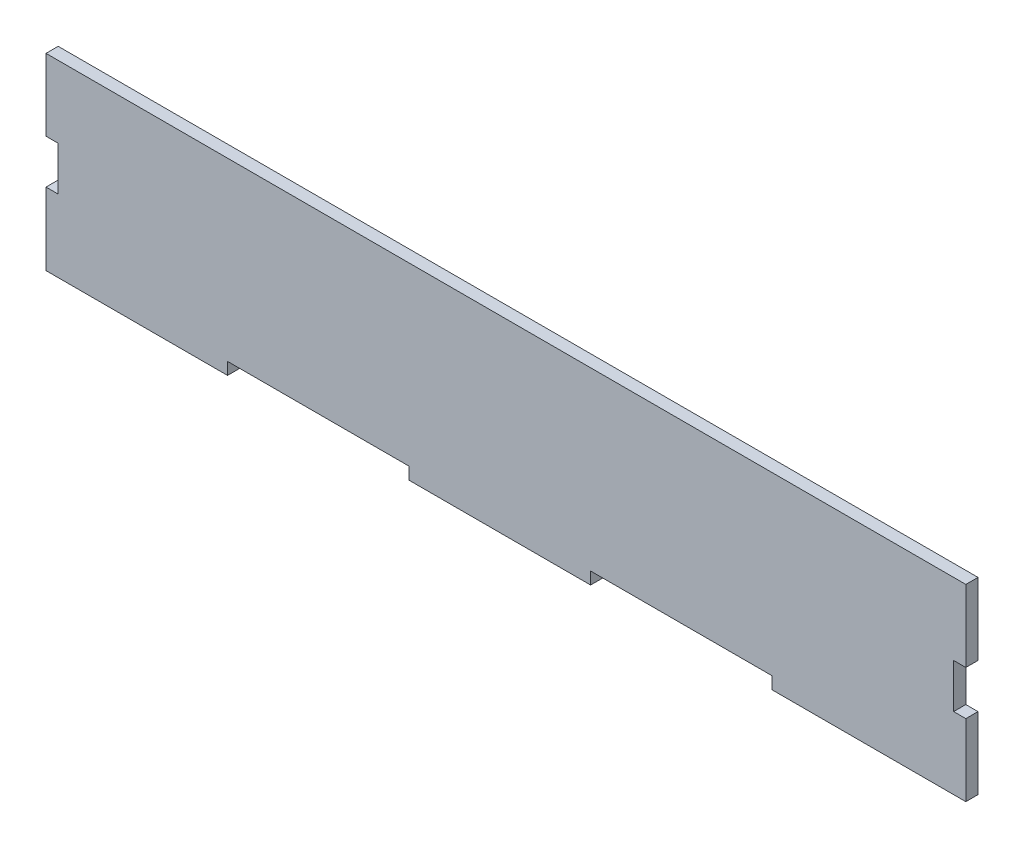
from build123d import *

# Parameters (mm, degrees)
SALIENTE_EXTRUIR1_DEPTH = 5.5


with BuildPart() as part:
    # Croquis1 → Saliente-Extruir1 (new body)
    with BuildSketch(Plane.XY):
        Polygon((-48.533930911, 1.420472202), (-48.533930911, 33.841356227), (366.966069089, 33.841356227), (366.966069089, 1.341356227), (361.466069089, 1.341356227), (361.466069089, -8.658643773), (361.466069089, -18.658643773), (366.966069089, -18.658643773), (366.966069089, -51.158643773), (279.466069089, -51.158643773), (279.466069089, -45.658643773), (197.466069089, -45.658643773), (197.466069089, -51.158643773), (115.466069089, -51.158643773), (115.466069089, -45.658643773), (33.466069089, -45.658643773), (33.466069089, -51.158643773), (-48.533930911, -51.158643773), (-48.533930911, -18.468850937), (-43.033930911, -18.468850937), (-43.033930911, 1.420472202), align=None)
    extrude(amount=SALIENTE_EXTRUIR1_DEPTH)


solid = part.part
